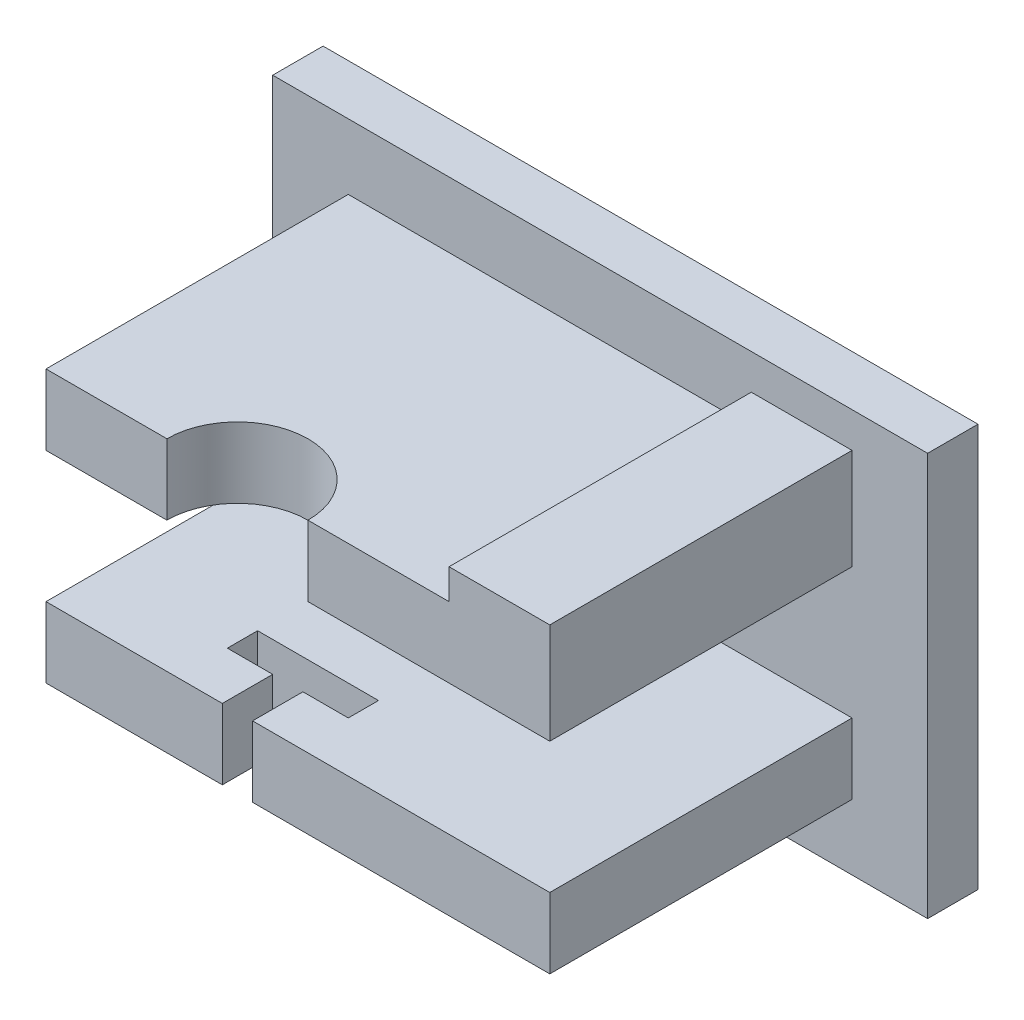
from build123d import *

# Parameters (mm, degrees)
SKETCH_1_W          = 65
SKETCH_1_H          = 40
EXTRUDE_1_DEPTH     = 5
SKETCH_2_W          = 50
SKETCH_2_H          = 7
SKETCH_2_W_2        = 10
SKETCH_2_H_2        = 3
EXTRUDE_2_DEPTH     = 30
SKETCH_4_R          = 7
CUT_EXTRUDE_1_DEPTH = 7
SKETCH_7_W          = 12
SKETCH_7_H          = 3
SKETCH_7_W_2        = 3
SKETCH_7_H_2        = 5
CUT_EXTRUDE_3_DEPTH = 7


with BuildPart() as part:
    # Эскиз1 → Бобышка-Вытянуть1 (new body)
    with BuildSketch(Plane.XY):
        Rectangle(SKETCH_1_W, SKETCH_1_H)
    extrude(amount=EXTRUDE_1_DEPTH)

    # Эскиз2 → Бобышка-Вытянуть2 (add)
    with BuildSketch(Plane.XY.offset(5)):
        with Locations((0, 10)):
            Rectangle(SKETCH_2_W, SKETCH_2_H)
        with Locations((20, 15)):
            Rectangle(SKETCH_2_W_2, SKETCH_2_H_2)
        with Locations((0, -10)):
            Rectangle(SKETCH_2_W, SKETCH_2_H)
    extrude(amount=EXTRUDE_2_DEPTH)

    # Эскиз4 → Вырез-Вытянуть1 (cut)
    with BuildSketch(Plane(origin=(0, 13.5, 0), x_dir=(1, 0, 0), z_dir=(0, 1, 0))):
        with Locations((-6, -35)):
            Circle(SKETCH_4_R)
    extrude(amount=-CUT_EXTRUDE_1_DEPTH, mode=Mode.SUBTRACT)

    # Эскиз7 → Вырез-Вытянуть3 (cut)
    with BuildSketch(Plane.XZ.offset(13.5)):
        with Locations((-6, 28.5)):
            Rectangle(SKETCH_7_W, SKETCH_7_H)
        with Locations((-6, 32.5)):
            Rectangle(SKETCH_7_W_2, SKETCH_7_H_2)
    extrude(amount=-CUT_EXTRUDE_3_DEPTH, mode=Mode.SUBTRACT)


solid = part.part
